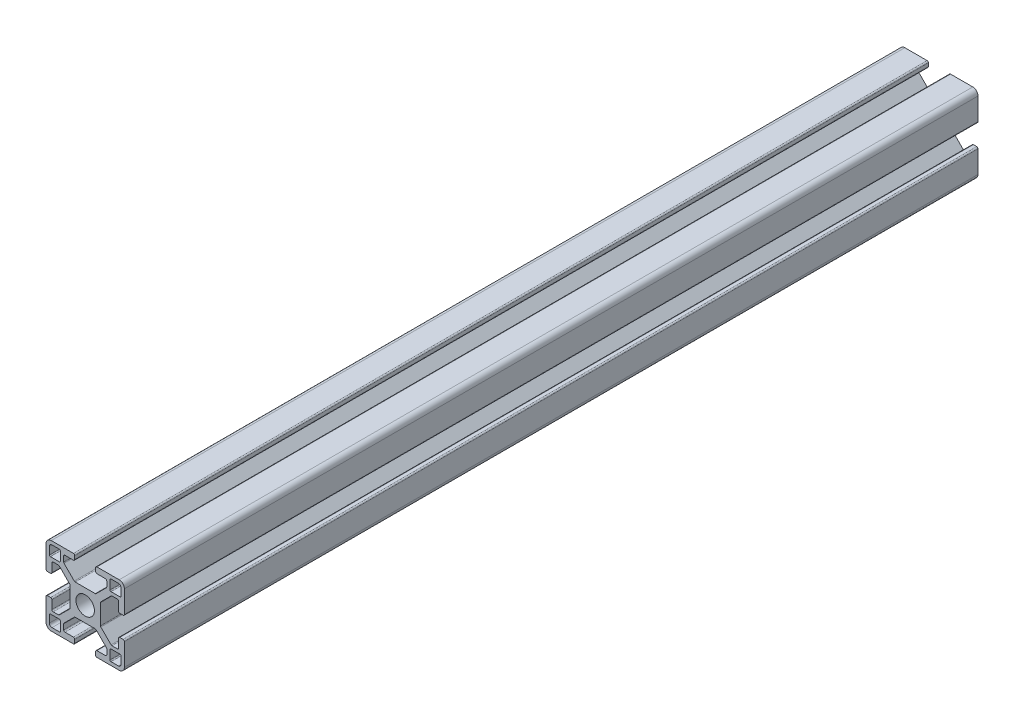
from build123d import *

# Parameters (mm, degrees)
SKETCH1_R           = 3.52998588
BOSS_EXTRUDE1_DEPTH = 163.322


with BuildPart() as part:
    # Sketch1 → Boss-Extrude1 (new, symmetric)
    with BuildSketch(Plane.XY):
        with BuildLine():
            Line((14.49994, -4), (13.24247465, -4))
            ThreePointArc((13.24247465, -4), (12.88892126, -4.146446609), (12.74247465, -4.5))
            Line((12.74247465, -4.5), (12.74247465, -7.732519321))
            ThreePointArc((12.74247465, -7.732519321), (12.602449697, -8.097296796), (12.242781236, -8.249967))
            Line((12.242781236, -8.249967), (10.260188032, -8.249967))
            ThreePointArc((10.260188032, -8.249967), (10.068847082, -8.211906919), (9.906636056, -8.103520976))
            Line((9.906636056, -8.103520976), (5.981117769, -4.178002689))
            ThreePointArc((5.981117769, -4.178002689), (5.872731827, -4.015791664), (5.834671745, -3.824450713))
            Line((5.834671745, -3.824450713), (5.834671745, -1.01249595))
            Line((5.834671745, -1.01249595), (5.834671745, 0.88749645))
            Line((5.834671745, 0.88749645), (5.834671745, 3.824450713))
            ThreePointArc((5.834671745, 3.824450713), (5.872731827, 4.015791664), (5.981117769, 4.178002689))
            Line((5.981117769, 4.178002689), (9.906636056, 8.103520976))
            ThreePointArc((9.906636056, 8.103520976), (10.068847082, 8.211906919), (10.260188032, 8.249967))
            Line((10.260188032, 8.249967), (12.242781236, 8.249967))
            ThreePointArc((12.242781236, 8.249967), (12.602449697, 8.097296796), (12.74247465, 7.732519321))
            Line((12.74247465, 7.732519321), (12.74247465, 4.5))
            ThreePointArc((12.74247465, 4.5), (12.88892126, 4.146446609), (13.24247465, 4))
            Line((13.24247465, 4), (14.49994, 4))
            ThreePointArc((14.49994, 4), (14.853493391, 4.146446609), (14.99994, 4.5))
            Line((14.99994, 4.5), (14.99994, 12.999948))
            ThreePointArc((14.99994, 12.999948), (14.414155906, 14.414155906), (12.999948, 14.99994))
            Line((12.999948, 14.99994), (4.5, 14.99994))
            ThreePointArc((4.5, 14.99994), (4.146446609, 14.853493391), (4, 14.49994))
            Line((4, 14.49994), (4, 13.24247465))
            ThreePointArc((4, 13.24247465), (4.146446609, 12.88892126), (4.5, 12.74247465))
            Line((4.5, 12.74247465), (7.732519321, 12.74247465))
            ThreePointArc((7.732519321, 12.74247465), (8.097296796, 12.602449697), (8.249967, 12.242781236))
            Line((8.249967, 12.242781236), (8.249967, 10.260188032))
            ThreePointArc((8.249967, 10.260188032), (8.211906919, 10.068847082), (8.103520976, 9.906636056))
            Line((8.103520976, 9.906636056), (4.178002689, 5.981117769))
            ThreePointArc((4.178002689, 5.981117769), (4.015791664, 5.872731827), (3.824450713, 5.834671745))
            Line((3.824450713, 5.834671745), (0.9499962, 5.834671745))
            Line((0.9499962, 5.834671745), (-0.9499962, 5.834671745))
            Line((-0.9499962, 5.834671745), (-3.824450713, 5.834671745))
            ThreePointArc((-3.824450713, 5.834671745), (-4.015791664, 5.872731827), (-4.178002689, 5.981117769))
            Line((-4.178002689, 5.981117769), (-8.103520976, 9.906636056))
            ThreePointArc((-8.103520976, 9.906636056), (-8.211906919, 10.068847082), (-8.249967, 10.260188032))
            Line((-8.249967, 10.260188032), (-8.249967, 12.242781236))
            ThreePointArc((-8.249967, 12.242781236), (-8.097296796, 12.602449697), (-7.732519321, 12.74247465))
            Line((-7.732519321, 12.74247465), (-4.5, 12.74247465))
            ThreePointArc((-4.5, 12.74247465), (-4.146446609, 12.88892126), (-4, 13.24247465))
            Line((-4, 13.24247465), (-4, 14.49994))
            ThreePointArc((-4, 14.49994), (-4.146446609, 14.853493391), (-4.5, 14.99994))
            Line((-4.5, 14.99994), (-12.999948, 14.99994))
            ThreePointArc((-12.999948, 14.99994), (-14.414155906, 14.414155906), (-14.99994, 12.999948))
            Line((-14.99994, 12.999948), (-14.99994, 4.5))
            ThreePointArc((-14.99994, 4.5), (-14.853493391, 4.146446609), (-14.49994, 4))
            Line((-14.49994, 4), (-13.24247465, 4))
            ThreePointArc((-13.24247465, 4), (-12.88892126, 4.146446609), (-12.74247465, 4.5))
            Line((-12.74247465, 4.5), (-12.74247465, 7.732519321))
            ThreePointArc((-12.74247465, 7.732519321), (-12.602449697, 8.097296796), (-12.242781236, 8.249967))
            Line((-12.242781236, 8.249967), (-10.260188032, 8.249967))
            ThreePointArc((-10.260188032, 8.249967), (-10.068847082, 8.211906919), (-9.906636056, 8.103520976))
            Line((-9.906636056, 8.103520976), (-5.981117769, 4.178002689))
            ThreePointArc((-5.981117769, 4.178002689), (-5.872731827, 4.015791664), (-5.834671745, 3.824450713))
            Line((-5.834671745, 3.824450713), (-5.834671745, 0.88749645))
            Line((-5.834671745, 0.88749645), (-5.834671745, -1.01249595))
            Line((-5.834671745, -1.01249595), (-5.834671745, -3.824450713))
            ThreePointArc((-5.834671745, -3.824450713), (-5.872731827, -4.015791664), (-5.981117769, -4.178002689))
            Line((-5.981117769, -4.178002689), (-9.906636056, -8.103520976))
            ThreePointArc((-9.906636056, -8.103520976), (-10.068847082, -8.211906919), (-10.260188032, -8.249967))
            Line((-10.260188032, -8.249967), (-12.242781236, -8.249967))
            ThreePointArc((-12.242781236, -8.249967), (-12.602449697, -8.097296796), (-12.74247465, -7.732519321))
            Line((-12.74247465, -7.732519321), (-12.74247465, -4.5))
            ThreePointArc((-12.74247465, -4.5), (-12.88892126, -4.146446609), (-13.24247465, -4))
            Line((-13.24247465, -4), (-14.49994, -4))
            ThreePointArc((-14.49994, -4), (-14.853493391, -4.146446609), (-14.99994, -4.5))
            Line((-14.99994, -4.5), (-14.99994, -12.999948))
            ThreePointArc((-14.99994, -12.999948), (-14.414155906, -14.414155906), (-12.999948, -14.99994))
            Line((-12.999948, -14.99994), (-4.5, -14.99994))
            ThreePointArc((-4.5, -14.99994), (-4.146446609, -14.853493391), (-4, -14.49994))
            Line((-4, -14.49994), (-4, -13.24247465))
            ThreePointArc((-4, -13.24247465), (-4.146446609, -12.88892126), (-4.5, -12.74247465))
            Line((-4.5, -12.74247465), (-7.732519321, -12.74247465))
            ThreePointArc((-7.732519321, -12.74247465), (-8.097296796, -12.602449697), (-8.249967, -12.242781236))
            Line((-8.249967, -12.242781236), (-8.249967, -10.260188032))
            ThreePointArc((-8.249967, -10.260188032), (-8.211906919, -10.068847082), (-8.103520976, -9.906636056))
            Line((-8.103520976, -9.906636056), (-4.178002689, -5.981117769))
            ThreePointArc((-4.178002689, -5.981117769), (-4.015791664, -5.872731827), (-3.824450713, -5.834671745))
            Line((-3.824450713, -5.834671745), (-0.9499962, -5.834671745))
            Line((-0.9499962, -5.834671745), (0.9499962, -5.834671745))
            Line((0.9499962, -5.834671745), (3.824450713, -5.834671745))
            ThreePointArc((3.824450713, -5.834671745), (4.015791664, -5.872731827), (4.178002689, -5.981117769))
            Line((4.178002689, -5.981117769), (8.103520976, -9.906636056))
            ThreePointArc((8.103520976, -9.906636056), (8.211906919, -10.068847082), (8.249967, -10.260188032))
            Line((8.249967, -10.260188032), (8.249967, -12.242781236))
            ThreePointArc((8.249967, -12.242781236), (8.097296796, -12.602449697), (7.732519321, -12.74247465))
            Line((7.732519321, -12.74247465), (4.5, -12.74247465))
            ThreePointArc((4.5, -12.74247465), (4.146446609, -12.88892126), (4, -13.24247465))
            Line((4, -13.24247465), (4, -14.49994))
            ThreePointArc((4, -14.49994), (4.146446609, -14.853493391), (4.5, -14.99994))
            Line((4.5, -14.99994), (12.999948, -14.99994))
            ThreePointArc((12.999948, -14.99994), (14.414155906, -14.414155906), (14.99994, -12.999948))
            Line((14.99994, -12.999948), (14.99994, -4.5))
            ThreePointArc((14.99994, -4.5), (14.853493391, -4.146446609), (14.49994, -4))
        make_face()
        Circle(SKETCH1_R, mode=Mode.SUBTRACT)
        with BuildLine():
            Line((-12.6999492, -13.6999452), (-9.880960476, -13.6999452))
            ThreePointArc((-9.880960476, -13.6999452), (-9.61155387, -13.58835333), (-9.499962, -13.318946724))
            Line((-9.499962, -13.318946724), (-9.499962, -9.87996048))
            ThreePointArc((-9.499962, -9.87996048), (-9.611260978, -9.611260978), (-9.87996048, -9.499962))
            Line((-9.87996048, -9.499962), (-13.318946724, -9.499962))
            ThreePointArc((-13.318946724, -9.499962), (-13.58835333, -9.61155387), (-13.6999452, -9.880960476))
            Line((-13.6999452, -9.880960476), (-13.6999452, -12.6999492))
            ThreePointArc((-13.6999452, -12.6999492), (-13.407053153, -13.407053153), (-12.6999492, -13.6999452))
        make_face(mode=Mode.SUBTRACT)
        with BuildLine():
            Line((13.6999452, -12.6999492), (13.6999452, -9.880960476))
            ThreePointArc((13.6999452, -9.880960476), (13.58835333, -9.61155387), (13.318946724, -9.499962))
            Line((13.318946724, -9.499962), (9.87996048, -9.499962))
            ThreePointArc((9.87996048, -9.499962), (9.611260978, -9.611260978), (9.499962, -9.87996048))
            Line((9.499962, -9.87996048), (9.499962, -13.318946724))
            ThreePointArc((9.499962, -13.318946724), (9.61155387, -13.58835333), (9.880960476, -13.6999452))
            Line((9.880960476, -13.6999452), (12.6999492, -13.6999452))
            ThreePointArc((12.6999492, -13.6999452), (13.407053153, -13.407053153), (13.6999452, -12.6999492))
        make_face(mode=Mode.SUBTRACT)
        with BuildLine():
            Line((9.87996048, 9.499962), (13.318946724, 9.499962))
            ThreePointArc((13.318946724, 9.499962), (13.58835333, 9.61155387), (13.6999452, 9.880960476))
            Line((13.6999452, 9.880960476), (13.6999452, 12.6999492))
            ThreePointArc((13.6999452, 12.6999492), (13.407053153, 13.407053153), (12.6999492, 13.6999452))
            Line((12.6999492, 13.6999452), (9.880960476, 13.6999452))
            ThreePointArc((9.880960476, 13.6999452), (9.61155387, 13.58835333), (9.499962, 13.318946724))
            Line((9.499962, 13.318946724), (9.499962, 9.87996048))
            ThreePointArc((9.499962, 9.87996048), (9.611260978, 9.611260978), (9.87996048, 9.499962))
        make_face(mode=Mode.SUBTRACT)
        with BuildLine():
            Line((-13.6999452, 12.6999492), (-13.6999452, 9.880960476))
            ThreePointArc((-13.6999452, 9.880960476), (-13.58835333, 9.61155387), (-13.318946724, 9.499962))
            Line((-13.318946724, 9.499962), (-9.87996048, 9.499962))
            ThreePointArc((-9.87996048, 9.499962), (-9.611260978, 9.611260978), (-9.499962, 9.87996048))
            Line((-9.499962, 9.87996048), (-9.499962, 13.318946724))
            ThreePointArc((-9.499962, 13.318946724), (-9.61155387, 13.58835333), (-9.880960476, 13.6999452))
            Line((-9.880960476, 13.6999452), (-12.6999492, 13.6999452))
            ThreePointArc((-12.6999492, 13.6999452), (-13.407053153, 13.407053153), (-13.6999452, 12.6999492))
        make_face(mode=Mode.SUBTRACT)
    extrude(amount=BOSS_EXTRUDE1_DEPTH, both=True)


solid = part.part
